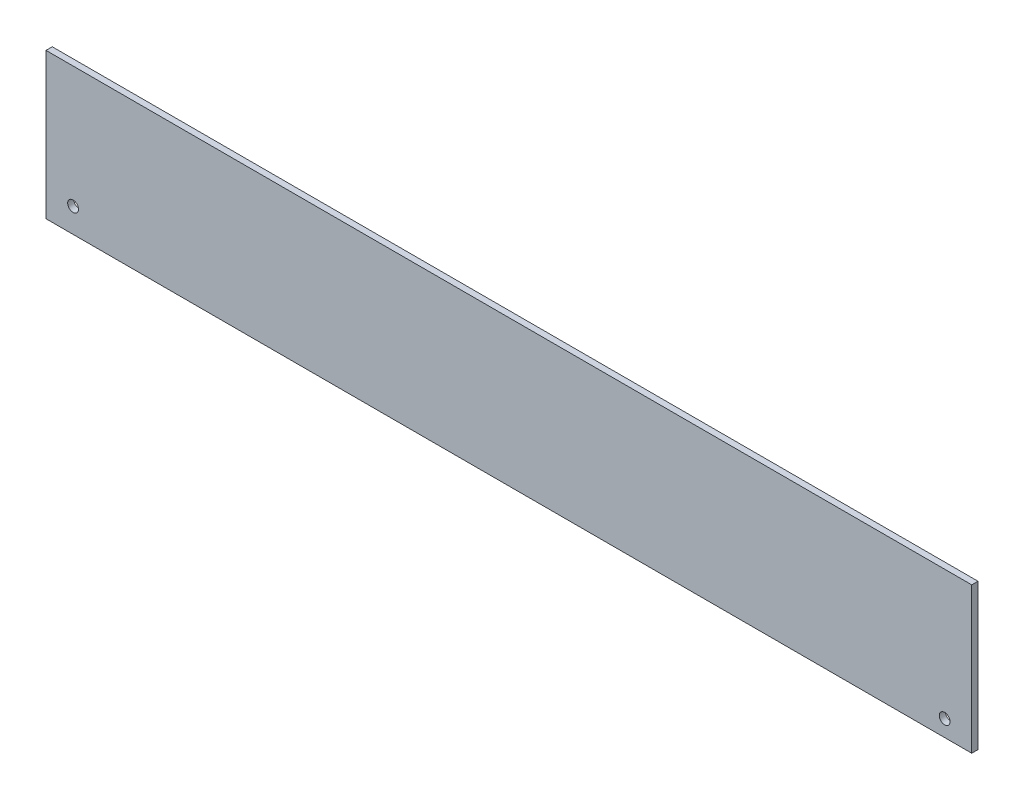
from build123d import *

# Parameters (mm, degrees)
ESQUISSE1_W             = 444.3
ESQUISSE1_H             = 70
BOSS_EXTRU_1_DEPTH      = 3
ESQUISSE2_R             = 2.6
ENL_V_MAT_EXTRU_1_DEPTH = 20


with BuildPart() as part:
    # Esquisse1 → Boss.-Extru.1 (new body)
    with BuildSketch(Plane.XY):
        with Locations((-222.15, 35)):
            Rectangle(ESQUISSE1_W, ESQUISSE1_H)
    extrude(amount=BOSS_EXTRU_1_DEPTH)

    # Esquisse2 → Enlèv. mat.-Extru.1 (cut)
    with BuildSketch(Plane(origin=(0, 0, 0), x_dir=(-1, 0, 0), z_dir=(0, 0, -1))):
        with Locations((13, 7.895886877)):
            Circle(ESQUISSE2_R)
        with Locations((431.3, 11.721719368)):
            Circle(ESQUISSE2_R)
    extrude(amount=-ENL_V_MAT_EXTRU_1_DEPTH, mode=Mode.SUBTRACT)


solid = part.part
